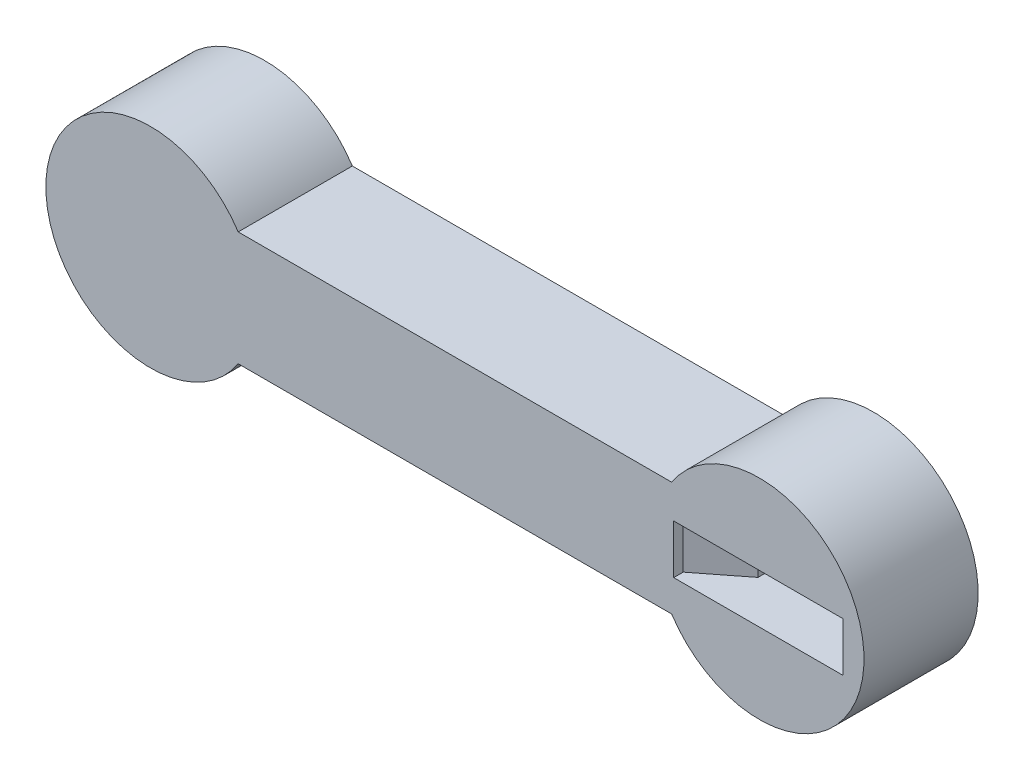
from build123d import *

# Parameters (mm, degrees)
BOSS_EXTRUDE1_DEPTH = 30
SKETCH16_W          = 33.4
SKETCH16_H          = 12.9
CUT_EXTRUDE10_DEPTH = 4.5
SKETCH17_W          = 23.45208563
SKETCH17_H          = 12.9
CUT_EXTRUDE11_DEPTH = 192.865838543
CUT_EXTRUDE13_DEPTH = 6.45
SKETCH19_R          = 20
CUT_EXTRUDE14_DEPTH = 8.8
SKETCH21_W          = 33.4
SKETCH21_H          = 12.9
CUT_EXTRUDE15_DEPTH = 191.957455995
SKETCH23_R          = 1.1
CUT_EXTRUDE16_DEPTH = 192.865838543


with BuildPart() as part:
    # Sketch1 → Boss-Extrude1 (new body)
    with BuildSketch(Plane.XY):
        with BuildLine():
            ThreePointArc((187.5, 0), (167.823244805, 26.363741023), (136.951138857, 15))
            Line((136.951138857, 15), (160, 15))
            Line((160, 15), (160, -15))
            Line((160, -15), (136.951138857, -15))
            ThreePointArc((136.951138857, -15), (167.823244805, -26.363741023), (187.5, 0))
        make_face()
        with BuildLine():
            Line((160, 15), (136.951138857, 15))
            ThreePointArc((136.951138857, 15), (132.5, 0), (136.951138857, -15))
            Line((136.951138857, -15), (160, -15))
            Line((160, -15), (160, 15))
        make_face()
        with BuildLine():
            Line((136.951138857, 15), (23.048861143, 15))
            ThreePointArc((23.048861143, 15), (26.363741023, 7.823244805), (27.5, 0))
            ThreePointArc((27.5, 0), (26.363741023, -7.823244805), (23.048861143, -15))
            Line((23.048861143, -15), (136.951138857, -15))
            ThreePointArc((136.951138857, -15), (132.5, 0), (136.951138857, 15))
        make_face()
        with BuildLine():
            ThreePointArc((13.228756555, -15), (-20, 0), (13.228756555, 15))
            Line((13.228756555, 15), (23.048861143, 15))
            ThreePointArc((23.048861143, 15), (-27.5, 0), (23.048861143, -15))
            Line((23.048861143, -15), (13.228756555, -15))
        make_face()
        with BuildLine():
            Line((23.048861143, 15), (13.228756555, 15))
            ThreePointArc((13.228756555, 15), (18.228756555, 8.228756555), (20, 0))
            ThreePointArc((20, 0), (18.228756555, -8.228756555), (13.228756555, -15))
            Line((13.228756555, -15), (23.048861143, -15))
            ThreePointArc((23.048861143, -15), (26.363741023, -7.823244805), (27.5, 0))
            ThreePointArc((27.5, 0), (26.363741023, 7.823244805), (23.048861143, 15))
        make_face()
        with BuildLine():
            Line((0, -15), (0, 15))
            Line((0, 15), (13.228756555, 15))
            ThreePointArc((13.228756555, 15), (-20, 0), (13.228756555, -15))
            Line((13.228756555, -15), (0, -15))
        make_face()
        with BuildLine():
            Line((13.228756555, 15), (0, 15))
            Line((0, 15), (0, -15))
            Line((0, -15), (13.228756555, -15))
            ThreePointArc((13.228756555, -15), (18.228756555, -8.228756555), (20, 0))
            ThreePointArc((20, 0), (18.228756555, 8.228756555), (13.228756555, 15))
        make_face()
    extrude(amount=BOSS_EXTRUDE1_DEPTH)

    # Sketch16 → Cut-Extrude10 (cut)
    with BuildSketch(Plane(origin=(0, 0, 0), x_dir=(-1, 0, 0), z_dir=(0, 0, -1))):
        with Locations((-165.21934279, 0)):
            Rectangle(SKETCH16_W, SKETCH16_H)
    extrude(amount=-CUT_EXTRUDE10_DEPTH, mode=Mode.SUBTRACT)

    # Sketch17 → Cut-Extrude11 (cut, through all)
    with BuildSketch(Plane(origin=(0, 0, 0), x_dir=(-1, 0, 0), z_dir=(0, 0, -1))):
        with Locations((-165.223957185, 0)):
            Rectangle(SKETCH17_W, SKETCH17_H)
    extrude(amount=-CUT_EXTRUDE11_DEPTH, mode=Mode.SUBTRACT)

    # Sketch18 → Cut-Extrude13 (cut, symmetric)
    with BuildSketch(Plane(origin=(0, 0, 0), x_dir=(-1, 0, 0), z_dir=(0, -1, 0))):
        Polygon((-153.49791437, -15), (-153.49791437, -30), (-137.49791437, -30), (-137.49791437, -27.5), align=None)
    extrude(amount=CUT_EXTRUDE13_DEPTH, both=True, mode=Mode.SUBTRACT)

    # Sketch19 → Cut-Extrude14 (cut)
    with BuildSketch(Plane(origin=(0, 0, 0), x_dir=(-1, 0, 0), z_dir=(0, 0, -1))):
        Circle(SKETCH19_R)
    extrude(amount=-CUT_EXTRUDE14_DEPTH, mode=Mode.SUBTRACT)

    # Sketch21 → Cut-Extrude15 (cut, through all)
    with BuildSketch(Plane(origin=(0, 0, 6.5), x_dir=(-1, 0, 0), z_dir=(0, 0, -1))):
        with Locations((-165.21934279, 0)):
            Rectangle(SKETCH21_W, SKETCH21_H)
    extrude(amount=-CUT_EXTRUDE15_DEPTH, mode=Mode.SUBTRACT)

    # Sketch23 → Cut-Extrude16 (cut, through all)
    with BuildSketch(Plane(origin=(0, 0, 0), x_dir=(-1, 0, 0), z_dir=(0, 0, -1))):
        with Locations((-151.71934279, 0)):
            Circle(SKETCH23_R)
        with Locations((-178.71934279, 0)):
            Circle(SKETCH23_R)
    extrude(amount=-CUT_EXTRUDE16_DEPTH, mode=Mode.SUBTRACT)


solid = part.part
